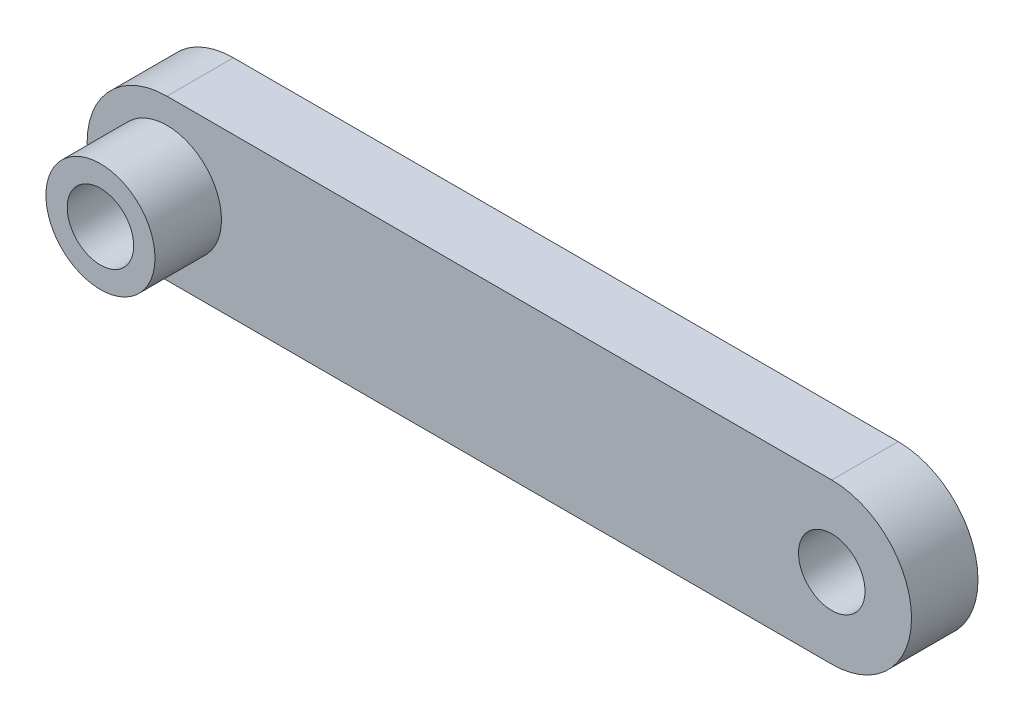
from build123d import *

# Parameters (mm, degrees)
BOSS_EXTRUDE2_DEPTH     = 12.7
SKETCH4_R               = 10.419425035
BOSS_EXTRUDE3_DEPTH     = 12.7
CUT_EXTRUDE1_DEPTH      = 144.616730223
CUT_EXTRUDE1_DEPTH_BACK = 144.616730223
SKETCH3_R               = 6.35


with BuildPart() as part:
    # Sketch2 → Boss-Extrude2 (new body)
    with BuildSketch(Plane.XY):
        with BuildLine():
            Line((0, 15.24), (127, 15.24))
            ThreePointArc((127, 15.24), (142.24, 0), (127, -15.24))
            Line((127, -15.24), (0, -15.24))
            ThreePointArc((0, -15.24), (-15.24, 0), (0, 15.24))
        make_face()
    extrude(amount=BOSS_EXTRUDE2_DEPTH)

    # Sketch4 → Boss-Extrude3 (add)
    with BuildSketch(Plane.XY.offset(12.7)):
        Circle(SKETCH4_R)
    extrude(amount=BOSS_EXTRUDE3_DEPTH)

    # Sketch3 → Cut-Extrude1 (cut, two sides: drawn at the far end of the back side and taken through both)
    with BuildSketch(Plane.XY.offset(12.7).offset(-CUT_EXTRUDE1_DEPTH_BACK)):
        Circle(SKETCH3_R)
        with Locations((127, 0)):
            Circle(SKETCH3_R)
    extrude(amount=CUT_EXTRUDE1_DEPTH + CUT_EXTRUDE1_DEPTH_BACK, mode=Mode.SUBTRACT)


solid = part.part
